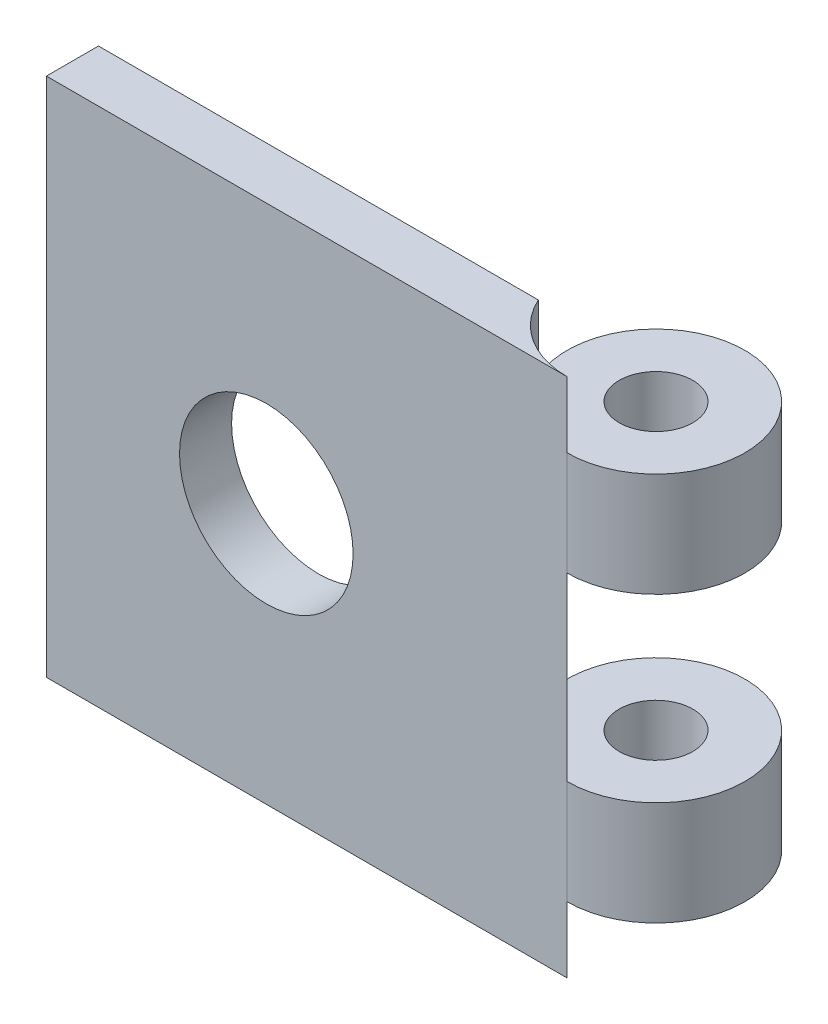
from build123d import *

# Parameters (mm, degrees)
BOSS_EXTRUDE1_DEPTH      = 7.5
BOSS_EXTRUDE1_DEPTH_BACK = 7.5
BOSS_EXTRUDE3_START      = 2.6
SKETCH1_4_R              = 1.06
BOSS_EXTRUDE3_DEPTH      = 3
BOSS_EXTRUDE4_START      = -5.6
SKETCH1_5_R              = 1.06
BOSS_EXTRUDE4_DEPTH      = 3
SKETCH2_R                = 2.5
CUT_EXTRUDE1_DEPTH       = 3


with BuildPart() as part:
    # Sketch1 → Boss-Extrude1 (new, two sides: drawn at the far end of the back side and taken through both)
    with BuildSketch(Plane(origin=(0, 0, 0), x_dir=(1, 0, 0), z_dir=(0, 1, 0)).offset(-BOSS_EXTRUDE1_DEPTH_BACK)):
        with BuildLine():
            Line((0, 1.5), (0, 0))
            Line((0, 0), (15, 0))
            ThreePointArc((15, 0), (13.614359354, 0.407420152), (12.66976396, 1.5))
            Line((12.66976396, 1.5), (0, 1.5))
        make_face()
    extrude(amount=BOSS_EXTRUDE1_DEPTH + BOSS_EXTRUDE1_DEPTH_BACK)

    # Sketch1<4> → Boss-Extrude3 (add)
    with BuildSketch(Plane(origin=(0, 0, 0), x_dir=(1, 0, 0), z_dir=(0, 1, 0)).offset(BOSS_EXTRUDE3_START)):
        with BuildLine():
            ThreePointArc((12.66976396, 1.5), (13.614359354, 0.407420152), (15, 0))
            ThreePointArc((15, 0), (16.81019336, 0.74980664), (17.56, 2.56))
            ThreePointArc((17.56, 2.56), (14.45769209, 5.061899704), (12.66976396, 1.5))
        make_face()
        with Locations((15, 2.56)):
            Circle(SKETCH1_4_R, mode=Mode.SUBTRACT)
    extrude(amount=BOSS_EXTRUDE3_DEPTH)

    # Sketch1<5> → Boss-Extrude4 (add)
    with BuildSketch(Plane(origin=(0, 0, 0), x_dir=(1, 0, 0), z_dir=(0, 1, 0)).offset(BOSS_EXTRUDE4_START)):
        with BuildLine():
            ThreePointArc((12.66976396, 1.5), (13.614359354, 0.407420152), (15, 0))
            ThreePointArc((15, 0), (16.81019336, 0.74980664), (17.56, 2.56))
            ThreePointArc((17.56, 2.56), (14.45769209, 5.061899704), (12.66976396, 1.5))
        make_face()
        with Locations((15, 2.56)):
            Circle(SKETCH1_5_R, mode=Mode.SUBTRACT)
    extrude(amount=BOSS_EXTRUDE4_DEPTH)

    # Sketch2 → Cut-Extrude1 (cut)
    with BuildSketch(Plane(origin=(0, 0, -1.5), x_dir=(-1, 0, 0), z_dir=(0, 0, -1))):
        with Locations((-6.33488198, 0)):
            Circle(SKETCH2_R)
    extrude(amount=-CUT_EXTRUDE1_DEPTH, mode=Mode.SUBTRACT)


solid = part.part
